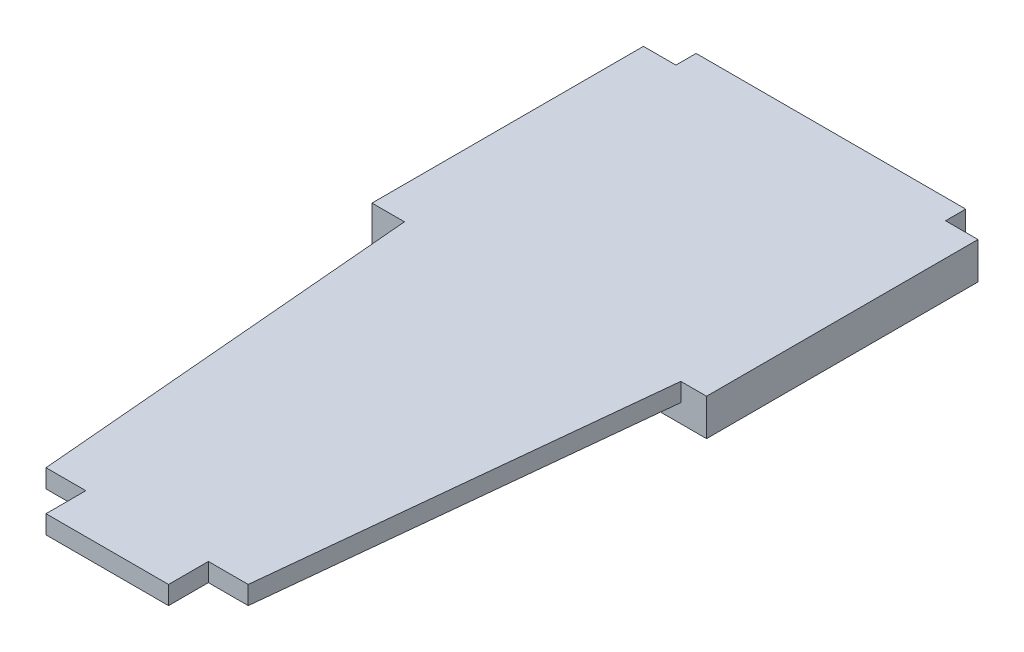
from build123d import *

# Parameters (mm, degrees)
BOSS_EXTRUDE1_DEPTH = 3
BOSS_EXTRUDE2_DEPTH = 3


with BuildPart() as part:
    # Sketch1 → Boss-Extrude1 (new body)
    with BuildSketch(Plane(origin=(0, 0, 0), x_dir=(1, 0, 0), z_dir=(0, 1, 0))):
        Polygon((-22, 64), (-16.5, 0), (-10, 0), (-10, -6.5), (10, -6.5), (10, 0), (16.5, 0), (23.1, 64), (27.3, 64), (27.3, 108.3), (22, 108.3), (22, 111.6), (-22, 111.6), (-22, 108.3), (-27.3, 108.3), (-27.3, 64), align=None)
    extrude(amount=BOSS_EXTRUDE1_DEPTH)

    # Sketch3 → Boss-Extrude2 (add)
    with BuildSketch(Plane.XZ):
        Polygon((-27.3, -64), (-27.3, -108.3), (-22, -108.3), (-22, -111.6), (22, -111.6), (22, -108.3), (27.3, -108.3), (27.3, -64), (23.1, -64), (-22, -64), align=None)
    extrude(amount=BOSS_EXTRUDE2_DEPTH)


solid = part.part
